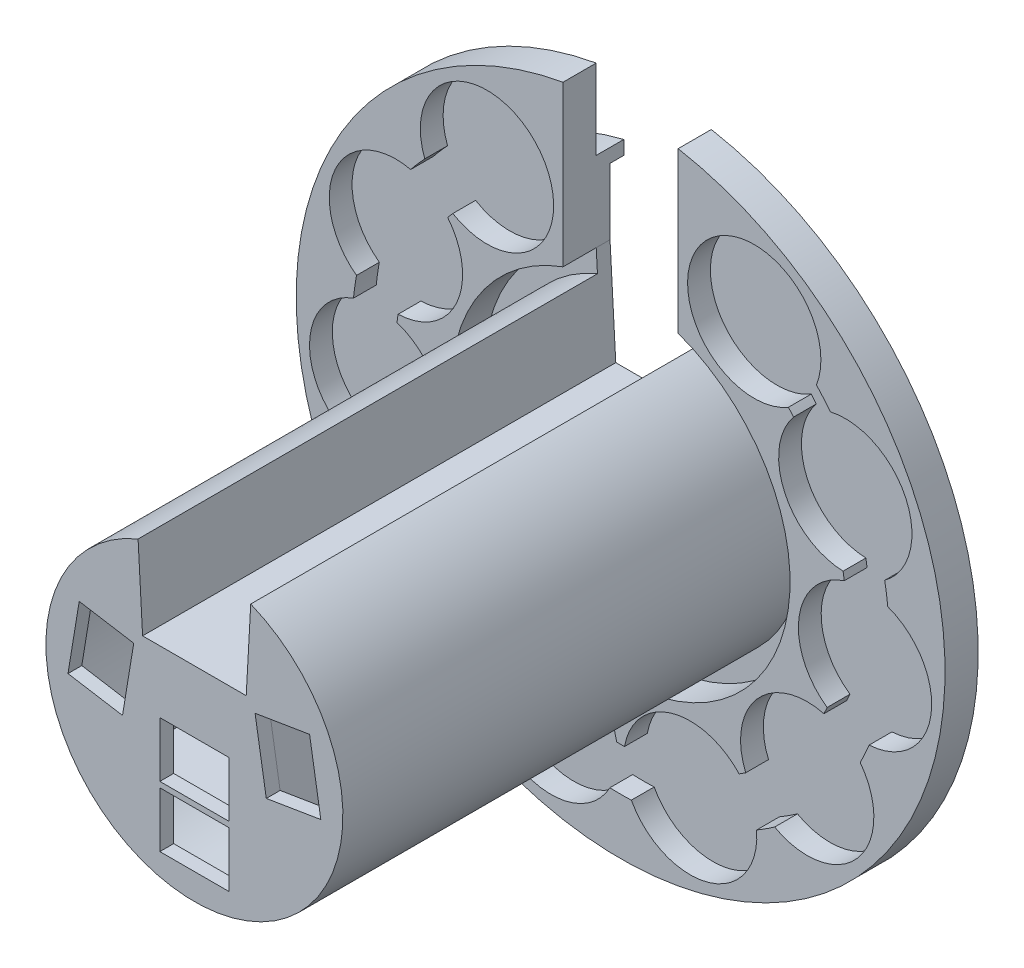
from build123d import *

# Parameters (mm, degrees)
BASIC_SHAPE_SKETCH_R                = 46.96825
BASIC_SHAPE_SKETCH_R_2              = 24.53175
BASIC_SHAPE_DEPTH                   = 4.8
BATTERY_SLOT_SKETCH_R               = 9.65
BATTERY_SLOT_DEPTH                  = 3.3
BATTERY_SLOT_PATTERN_COUNT          = 5
BATTERY_SLOT_PATTERN_ANGLE          = 130.88
BATTERY_SLOT_MIRROR_COPY_1_SKETCH_R = 9.65
BATTERY_SLOT_MIRROR_COPY_1_DEPTH    = 3.3
BATTERY_SLOT_MIRROR_COPY_2_SKETCH_R = 9.65
BATTERY_SLOT_MIRROR_COPY_2_DEPTH    = 3.3
BATTERY_SLOT_MIRROR_COPY_3_SKETCH_R = 9.65
BATTERY_SLOT_MIRROR_COPY_3_DEPTH    = 3.3
BATTERY_SLOT_MIRROR_COPY_4_SKETCH_R = 9.65
BATTERY_SLOT_MIRROR_COPY_4_DEPTH    = 3.3
SLIT_DEPTH                          = 67.596343865
BUS_SLIT_DEPTH                      = 3.3
CAP_2_DEPTH                         = 2
PLUNGER_DEPTH                       = 66.5
PLUNGER_CAVITY_DEPTH                = 66.5
LIP_DEPTH                           = 2
EXTRA_CUT_DEPTH                     = 94.990866663
BARRIERS_DEPTH                      = 51.5
SKETCH15_W                          = 10
SKETCH15_H                          = 8
CUT_EXTRUDE6_DEPTH                  = 96.416366605


with BuildPart() as part:
    # Basic_Shape_Sketch → Basic_Shape (new body)
    with BuildSketch(Plane.XY):
        Circle(BASIC_SHAPE_SKETCH_R)
        Circle(BASIC_SHAPE_SKETCH_R_2, mode=Mode.SUBTRACT)
    extrude(amount=BASIC_SHAPE_DEPTH)

    # Battery_Slot_Sketch → Battery_Slot (cut)
    with BuildSketch(Plane.XY.offset(4.8)):
        with Locations((-10.069761866, -34.302512969)):
            Circle(BATTERY_SLOT_SKETCH_R)
    battery_slot = extrude(amount=-BATTERY_SLOT_DEPTH, mode=Mode.SUBTRACT)

    # Battery_Slot_Pattern: Battery_Slot ×5 about axis
    battery_slot_pattern_axis = Axis((0, 0, 0), (0, 0, -1))
    for i in range(1, BATTERY_SLOT_PATTERN_COUNT):
        add(battery_slot.rotate(battery_slot_pattern_axis, i * BATTERY_SLOT_PATTERN_ANGLE / (BATTERY_SLOT_PATTERN_COUNT - 1)), mode=Mode.SUBTRACT)

    # Battery_Slot_Mirror: Battery_Slot across plane
    add(battery_slot.mirror(Plane(origin=(0, 0, 0), x_dir=(0, 0, 1), z_dir=(1, 0, 0))), mode=Mode.SUBTRACT)

    # Battery_Slot_Mirror copy 1 sketch → Battery_Slot_Mirror copy 1 (cut)
    with BuildSketch(Plane(origin=(0, 0, 4.8), x_dir=(-0.8413221512344797, -0.5405340302350882, 0), z_dir=(0, 0, 1))):
        with Locations((-10.069761866, 34.302512969)):
            Circle(BATTERY_SLOT_MIRROR_COPY_1_SKETCH_R)
    extrude(amount=-BATTERY_SLOT_MIRROR_COPY_1_DEPTH, mode=Mode.SUBTRACT)

    # Battery_Slot_Mirror copy 2 sketch → Battery_Slot_Mirror copy 2 (cut)
    with BuildSketch(Plane(origin=(0, 0, 4.8), x_dir=(-0.4156459243156256, -0.9095265062656553, 0), z_dir=(0, 0, 1))):
        with Locations((-10.069761866, 34.302512969)):
            Circle(BATTERY_SLOT_MIRROR_COPY_2_SKETCH_R)
    extrude(amount=-BATTERY_SLOT_MIRROR_COPY_2_DEPTH, mode=Mode.SUBTRACT)

    # Battery_Slot_Mirror copy 3 sketch → Battery_Slot_Mirror copy 3 (cut)
    with BuildSketch(Plane(origin=(0, 0, 4.8), x_dir=(0.14193790484034807, -0.9898755634773152, 0), z_dir=(0, 0, 1))):
        with Locations((-10.069761866, 34.302512969)):
            Circle(BATTERY_SLOT_MIRROR_COPY_3_SKETCH_R)
    extrude(amount=-BATTERY_SLOT_MIRROR_COPY_3_DEPTH, mode=Mode.SUBTRACT)

    # Battery_Slot_Mirror copy 4 sketch → Battery_Slot_Mirror copy 4 (cut)
    with BuildSketch(Plane(origin=(0, 0, 4.8), x_dir=(0.6544769311996185, -0.7560819707726999, 0), z_dir=(0, 0, 1))):
        with Locations((-10.069761866, 34.302512969)):
            Circle(BATTERY_SLOT_MIRROR_COPY_4_SKETCH_R)
    extrude(amount=-BATTERY_SLOT_MIRROR_COPY_4_DEPTH, mode=Mode.SUBTRACT)

    # Slit_Sketch → Slit (cut, through all)
    with BuildSketch(Plane.XY.offset(4.8)):
        with BuildLine():
            Line((-8.33, 46.223669349), (-8.33, 23.074181634))
            Line((-8.33, 23.074181634), (8.33, 23.074181634))
            Line((8.33, 23.074181634), (8.33, 46.223669349))
            ThreePointArc((8.33, 46.223669349), (0, 54.553669349), (-8.33, 46.223669349))
        make_face()
    extrude(amount=-SLIT_DEPTH, mode=Mode.SUBTRACT)

    # Bus_Slit_Sketch → Bus_Slit (cut)
    with BuildSketch(Plane.XY.offset(4.8)):
        with BuildLine():
            ThreePointArc((-9.754463235, 31.132636766), (0, -32.625), (9.754463235, 31.132636766))
            ThreePointArc((9.754463235, 31.132636766), (10.629095474, 34.20551129), (12.459123069, 36.824392423))
            ThreePointArc((12.459123069, 36.824392423), (0, -38.875), (-12.459123069, 36.824392423))
            ThreePointArc((-12.459123069, 36.824392423), (-10.629095474, 34.20551129), (-9.754463235, 31.132636766))
        make_face()
    extrude(amount=-BUS_SLIT_DEPTH, mode=Mode.SUBTRACT)

    # Cap_2_Sketch → Cap_2 (add)
    with BuildSketch(Plane(origin=(0, 0, 0), x_dir=(-1, 0, 0), z_dir=(0, 0, -1))):
        with BuildLine():
            Line((-8.33, 34.648925491), (-8.33, 23.074181634))
            Line((-8.33, 23.074181634), (8.33, 23.074181634))
            Line((8.33, 23.074181634), (8.33, 34.648925491))
            ThreePointArc((8.33, 34.648925491), (0, -35.636174566), (-8.33, 34.648925491))
        make_face()
    extrude(amount=CAP_2_DEPTH)

    # Sketch1 → Plunger (add)
    with BuildSketch(Plane.XY):
        with BuildLine():
            Line((-7.5, 8.074181634), (7.5, 8.074181634))
            Line((7.5, 8.074181634), (8.154017112, 19.893767993))
            ThreePointArc((8.154017112, 19.893767993), (0, -21.5), (-8.154017112, 19.893767993))
            Line((-8.154017112, 19.893767993), (-7.5, 8.074181634))
        make_face()
    extrude(amount=PLUNGER_DEPTH)

    # Sketch11 → Plunger Cavity (cut)
    with BuildSketch(Plane(origin=(0, 0, -2), x_dir=(-1, 0, 0), z_dir=(0, 0, -1))):
        with BuildLine():
            Line((-8.61374371, 19.152112659), (-7.973098193, 7.574181634))
            Line((-7.973098193, 7.574181634), (7.973098193, 7.574181634))
            Line((7.973098193, 7.574181634), (8.61374371, 19.152112659))
            ThreePointArc((8.61374371, 19.152112659), (0, -21), (-8.61374371, 19.152112659))
        make_face()
    extrude(amount=-PLUNGER_CAVITY_DEPTH, mode=Mode.SUBTRACT)

    # Sketch10 → Lip (add)
    with BuildSketch(Plane(origin=(0, 0, -2), x_dir=(-1, 0, 0), z_dir=(0, 0, -1))):
        with BuildLine():
            Line((-8.33, 34.648925491), (-8.33, 32.648925491))
            ThreePointArc((-8.33, 32.648925491), (0, -33.694825059), (8.33, 32.648925491))
            Line((8.33, 32.648925491), (8.33, 34.648925491))
            ThreePointArc((8.33, 34.648925491), (0, -35.636174566), (-8.33, 34.648925491))
        make_face()
    extrude(amount=LIP_DEPTH)

    # Sketch12 → Extra_Cut (cut, through all)
    with BuildSketch(Plane.XY):
        Polygon((-7.5, 8.074181634), (-8.33, 23.074181634), (8.33, 23.074181634), (7.5, 8.074181634), align=None)
    extrude(amount=-EXTRA_CUT_DEPTH, mode=Mode.SUBTRACT)

    # Sketch14 → Barriers (add)
    with BuildSketch(Plane(origin=(0, 0, 13), x_dir=(-1, 0, 0), z_dir=(0, 0, -1))):
        with BuildLine():
            Line((-8.094524385, 9.768630899), (-12.482303066, -16.88763187))
            ThreePointArc((-12.482303066, -16.88763187), (-12.256826493, -17.051985349), (-12.029186165, -17.213328562))
            Line((-12.029186165, -17.213328562), (-10.771652468, -9.573665961))
            Line((-10.771652468, -9.573665961), (10.771652468, -9.573665961))
            Line((10.771652468, -9.573665961), (12.029186165, -17.213328562))
            ThreePointArc((12.029186165, -17.213328562), (12.256826493, -17.051985349), (12.482303066, -16.88763187))
            Line((12.482303066, -16.88763187), (8.094524385, 9.768630899))
            Line((8.094524385, 9.768630899), (7.959093124, 7.574181634))
            Line((7.959093124, 7.574181634), (10.699314208, -9.072978255))
            Line((10.699314208, -9.072978255), (-10.699314208, -9.072978255))
            Line((-10.699314208, -9.072978255), (-7.959093124, 7.574181634))
            Line((-7.959093124, 7.574181634), (-8.094524385, 9.768630899))
        make_face()
    extrude(amount=-BARRIERS_DEPTH)

    # Sketch15 → Cut-Extrude6 (cut, through all)
    with BuildSketch(Plane(origin=(0, 0, 64.5), x_dir=(-1, 0, 0), z_dir=(0, 0, -1))):
        Polygon((-16.676224256, 7.812290296), (-8.782450836, 6.512928453), (-10.40665314, -3.354288322), (-18.30042656, -2.054926479), align=None)
        Polygon((8.782450836, 6.512928453), (16.676224256, 7.812290296), (18.30042656, -2.054926479), (10.40665314, -3.354288322), align=None)
        with Locations((0, -4.922978255)):
            Rectangle(SKETCH15_W, SKETCH15_H)
        with Locations((0, -13.723665961)):
            Rectangle(SKETCH15_W, SKETCH15_H)
    extrude(amount=-CUT_EXTRUDE6_DEPTH, mode=Mode.SUBTRACT)


solid = part.part
